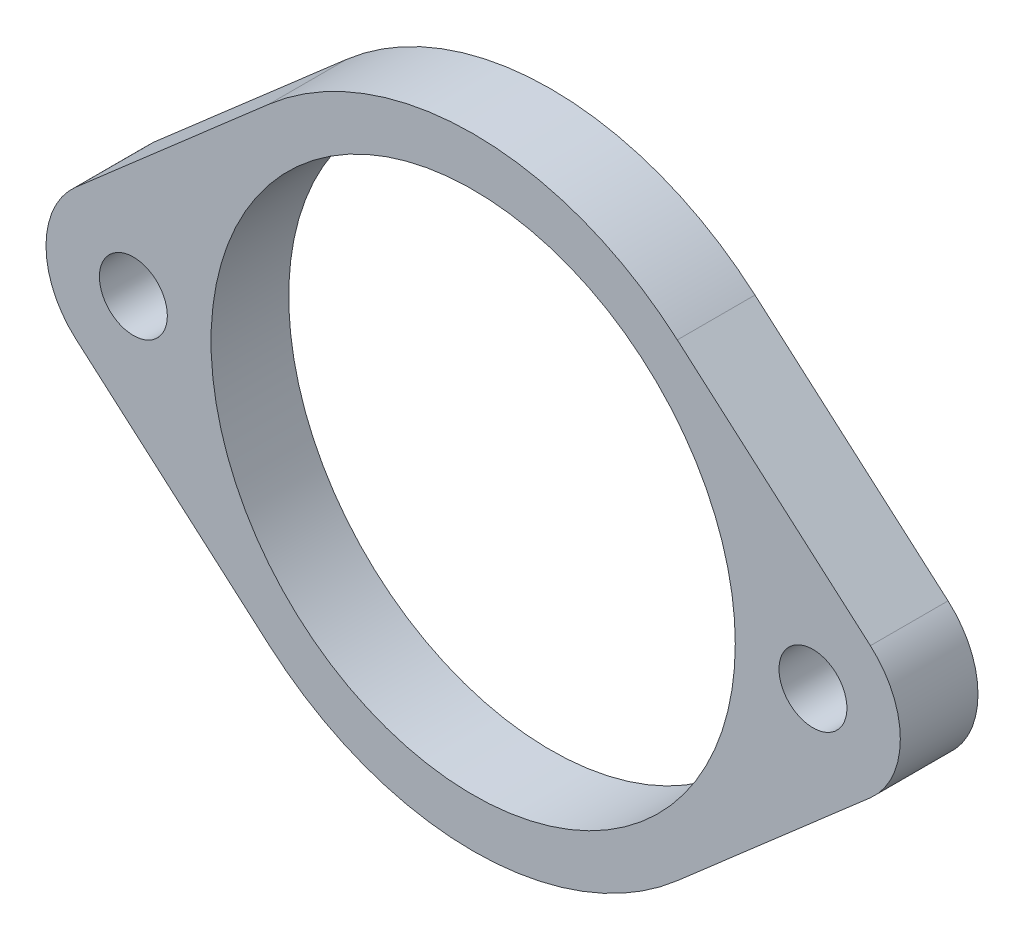
from build123d import *

# Parameters (mm, degrees)
SKETCH1_R           = 2.778125
SKETCH1_R_2         = 21.43125
BOSS_EXTRUDE1_DEPTH = 6.35


with BuildPart() as part:
    # Sketch1 → Boss-Extrude1 (new body)
    with BuildSketch(Plane.XY):
        with BuildLine():
            Line((-16.691428571, 19.145657791), (-32.475714286, 5.384716254))
            ThreePointArc((-32.475714286, 5.384716254), (-34.925, 0), (-32.475714286, -5.384716254))
            Line((-32.475714286, -5.384716254), (-16.691428571, -19.145657791))
            ThreePointArc((-16.691428571, -19.145657791), (0, -25.4), (16.691428571, -19.145657791))
            Line((16.691428571, -19.145657791), (32.475714286, -5.384716254))
            ThreePointArc((32.475714286, -5.384716254), (34.925, 0), (32.475714286, 5.384716254))
            Line((32.475714286, 5.384716254), (16.691428571, 19.145657791))
            ThreePointArc((16.691428571, 19.145657791), (0, 25.4), (-16.691428571, 19.145657791))
        make_face()
        with Locations((27.78125, 0)):
            Circle(SKETCH1_R, mode=Mode.SUBTRACT)
        with Locations((-27.78125, 0)):
            Circle(SKETCH1_R, mode=Mode.SUBTRACT)
        Circle(SKETCH1_R_2, mode=Mode.SUBTRACT)
    extrude(amount=BOSS_EXTRUDE1_DEPTH)


solid = part.part
